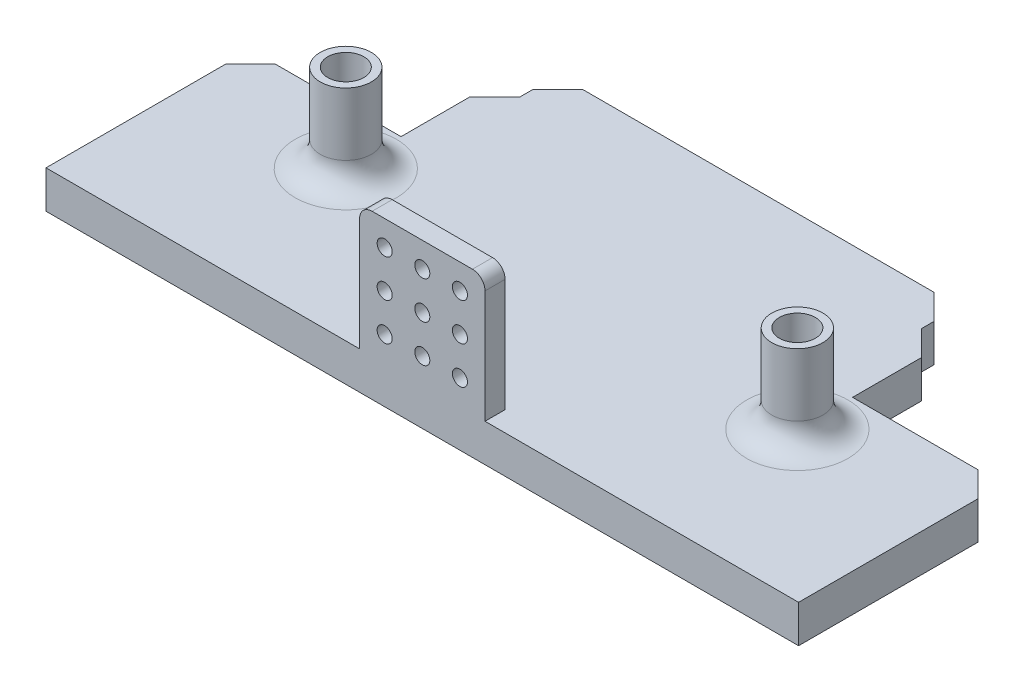
from build123d import *

# Parameters (mm, degrees)
SKETCH1_W           = 150
SKETCH1_H           = 59.51
BOSS_EXTRUDE1_DEPTH = 7.5
SKETCH2_R           = 5.1
BOSS_EXTRUDE2_DEPTH = 17.5
FILLET1_R           = 5
SKETCH3_R           = 3.6
CUT_EXTRUDE1_DEPTH  = 25
SKETCH4_W           = 30
SKETCH4_H           = 7.5
CUT_EXTRUDE2_DEPTH  = 18.75
CHAMFER1_SIZE       = 5
SKETCH5_W           = 80
SKETCH5_H           = 7.5
BOSS_EXTRUDE3_DEPTH = 7.5
CHAMFER2_SIZE       = 5
SKETCH6_R           = 1.5
CUT_EXTRUDE3_DEPTH  = 7.5
SKETCH7_W           = 25
SKETCH7_H           = 4
BOSS_EXTRUDE4_DEPTH = 25
SKETCH8_R           = 1.5
CUT_EXTRUDE4_DEPTH  = 5
FILLET2_R           = 2.5


with BuildPart() as part:
    # Sketch1 → Boss-Extrude1 (new body)
    with BuildSketch(Plane(origin=(0, 0, 0), x_dir=(1, 0, 0), z_dir=(0, 1, 0))):
        Rectangle(SKETCH1_W, SKETCH1_H)
    extrude(amount=BOSS_EXTRUDE1_DEPTH)

    # Sketch2 → Boss-Extrude2 (add)
    with BuildSketch(Plane(origin=(0, 7.5, 0), x_dir=(1, 0, 0), z_dir=(0, 1, 0))):
        with Locations(Location((-45, 0, 0), (0, 0, 270))):
            Circle(SKETCH2_R)
        with Locations(Location((45, 0, 0), (0, 0, 270))):
            Circle(SKETCH2_R)
    extrude(amount=BOSS_EXTRUDE2_DEPTH)

    # Fillet1
    fillet1_edges = [part.edges().sort_by_distance(p)[0] for p in [
        (-45, 7.5, -5.1),
        (45, 7.5, -5.1),
    ]]
    fillet(fillet1_edges, radius=FILLET1_R)

    # Sketch3 → Cut-Extrude1 (cut)
    with BuildSketch(Plane(origin=(0, 25, 0), x_dir=(1, 0, 0), z_dir=(0, 1, 0))):
        with Locations(Location((-45, 0, 0), (0, 0, 270))):
            Circle(SKETCH3_R)
        with Locations(Location((45, 0, 0), (0, 0, 270))):
            Circle(SKETCH3_R)
    extrude(amount=-CUT_EXTRUDE1_DEPTH, mode=Mode.SUBTRACT)

    # Sketch4 → Cut-Extrude2 (cut)
    with BuildSketch(Plane(origin=(0, 0, -29.755), x_dir=(-1, 0, 0), z_dir=(0, 0, -1))):
        with Locations((-60, 3.75)):
            Rectangle(SKETCH4_W, SKETCH4_H)
        with Locations((60, 3.75)):
            Rectangle(SKETCH4_W, SKETCH4_H)
    extrude(amount=-CUT_EXTRUDE2_DEPTH, mode=Mode.SUBTRACT)

    # Chamfer1
    chamfer1_edges = [part.edges().sort_by_distance(p)[0] for p in [
        (75, 3.75, -11.005),
        (45, 3.75, -29.755),
        (-75, 3.75, -11.005),
        (-45, 3.75, -29.755),
    ]]
    chamfer(chamfer1_edges, length=CHAMFER1_SIZE)

    # Sketch5 → Boss-Extrude3 (add)
    with BuildSketch(Plane(origin=(0, 0, -29.755), x_dir=(-1, 0, 0), z_dir=(0, 0, -1))):
        with Locations((0, 3.75)):
            Rectangle(SKETCH5_W, SKETCH5_H)
    extrude(amount=BOSS_EXTRUDE3_DEPTH)

    # Chamfer2
    chamfer2_edges = [part.edges().sort_by_distance(p)[0] for p in [
        (40, 3.75, -37.255),
        (-40, 3.75, -37.255),
    ]]
    chamfer(chamfer2_edges, length=CHAMFER2_SIZE)

    # Sketch6 → Cut-Extrude3 (cut)
    with BuildSketch(Plane(origin=(0, 0, -37.255), x_dir=(-1, 0, 0), z_dir=(0, 0, -1))):
        with Locations((-15, 3.75)):
            Circle(SKETCH6_R)
        with Locations((15, 3.75)):
            Circle(SKETCH6_R)
    extrude(amount=-CUT_EXTRUDE3_DEPTH, mode=Mode.SUBTRACT)

    # Sketch7 → Boss-Extrude4 (add)
    with BuildSketch(Plane(origin=(0, 7.5, 0), x_dir=(1, 0, 0), z_dir=(0, 1, 0))):
        with Locations((0, -27.755)):
            Rectangle(SKETCH7_W, SKETCH7_H)
    extrude(amount=BOSS_EXTRUDE4_DEPTH)

    # Sketch8 → Cut-Extrude4 (cut)
    with BuildSketch(Plane(origin=(0, 0, 25.755), x_dir=(-1, 0, 0), z_dir=(0, 0, -1))):
        with Locations((-7.5, 20)):
            Circle(SKETCH8_R)
        with Locations((0, 20)):
            Circle(SKETCH8_R)
        with Locations((-7.5, 27.5)):
            Circle(SKETCH8_R)
        with Locations((0, 27.5)):
            Circle(SKETCH8_R)
        with Locations((7.5, 27.5)):
            Circle(SKETCH8_R)
        with Locations((7.5, 20)):
            Circle(SKETCH8_R)
        with Locations((-7.5, 12.5)):
            Circle(SKETCH8_R)
        with Locations((0, 12.5)):
            Circle(SKETCH8_R)
        with Locations((7.5, 12.5)):
            Circle(SKETCH8_R)
    extrude(amount=-CUT_EXTRUDE4_DEPTH, mode=Mode.SUBTRACT)

    # Fillet2
    fillet2_edges = [part.edges().sort_by_distance(p)[0] for p in [
        (-12.5, 32.5, 27.755),
        (12.5, 32.5, 27.755),
    ]]
    fillet(fillet2_edges, radius=FILLET2_R)


solid = part.part
